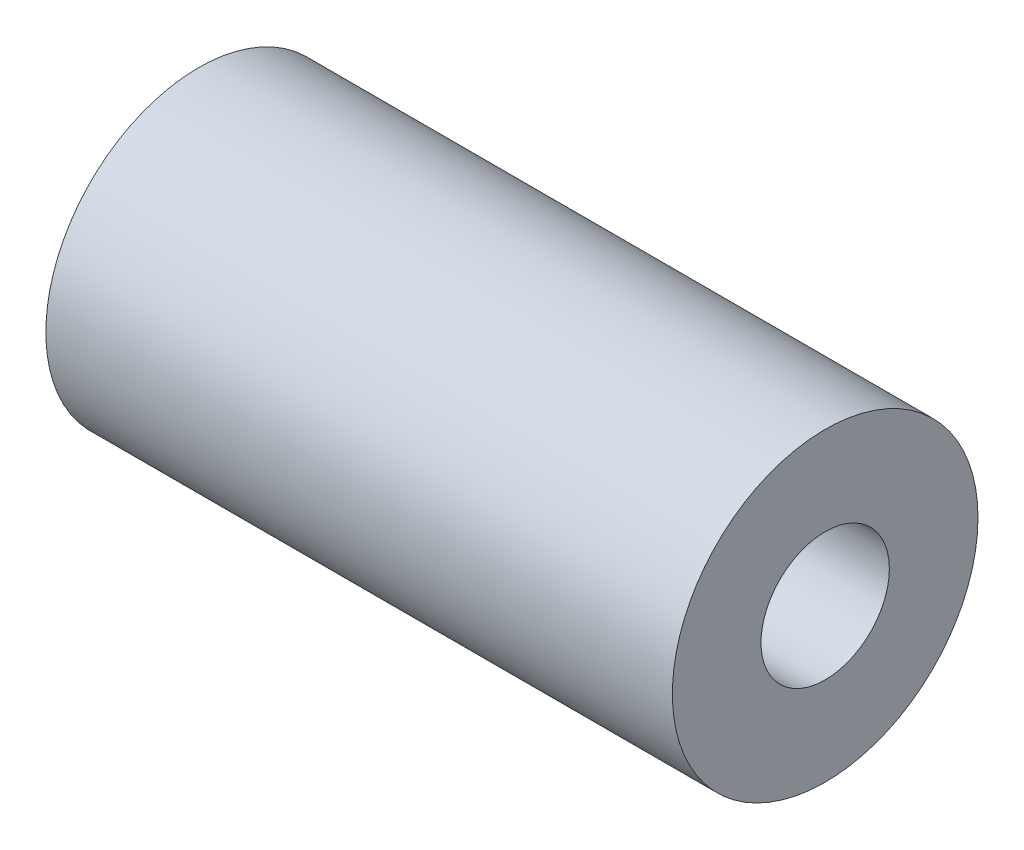
from build123d import *

# Parameters (mm, degrees)
SKETCH1_R             = 10
BOSS_EXTRUDE1_DEPTH   = 41
F_8_0MM_DOWEL_HOLE1_D = 8.4


with BuildPart() as part:
    # Sketch1 → Boss-Extrude1 (new body)
    with BuildSketch(Plane(origin=(0, 0, 0), x_dir=(0, 0, -1), z_dir=(1, 0, 0))):
        Circle(SKETCH1_R)
    extrude(amount=BOSS_EXTRUDE1_DEPTH)

    # Ø8.0mm Dowel Hole1 (through all)
    with Locations(Plane(origin=(41, 0, 0), x_dir=(0, 0, -1), z_dir=(1, 0, 0))):
        with Locations((0, 0)):
            Hole(F_8_0MM_DOWEL_HOLE1_D / 2)


solid = part.part
